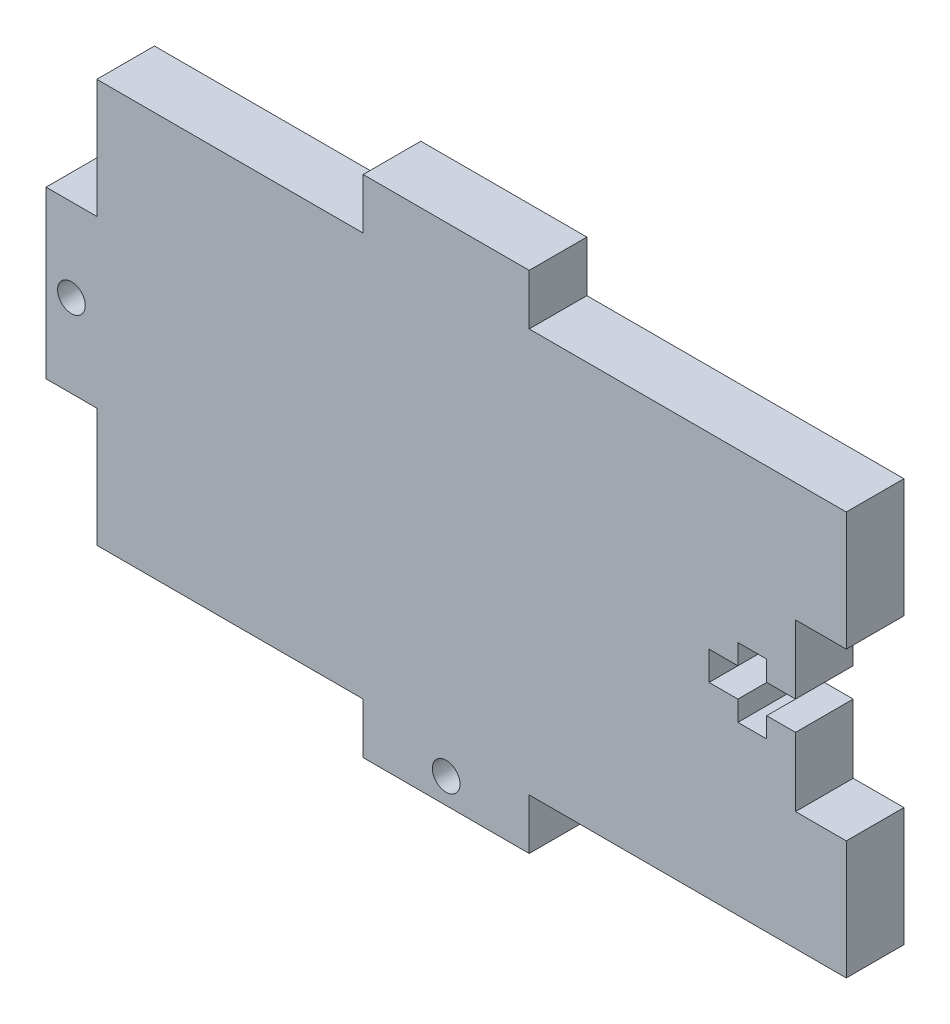
from build123d import *

# Parameters (mm, degrees)
SKETCH1_W           = 82.55
SKETCH1_H           = 44.45
BOSS_EXTRUDE1_DEPTH = 6.35
SKETCH2_W           = 5.588
SKETCH2_H           = 18.288
BOSS_EXTRUDE2_DEPTH = 6.35
SKETCH5_W           = 18.288
SKETCH5_H           = 5.588
BOSS_EXTRUDE3_DEPTH = 6.35
SKETCH3_W           = 5.588
SKETCH3_H           = 18.288
CUT_EXTRUDE1_DEPTH  = 97.739994025
SKETCH6_R           = 1.524
CUT_EXTRUDE2_DEPTH  = 97.739994025


with BuildPart() as part:
    # Sketch1 → Boss-Extrude1 (new body)
    with BuildSketch(Plane.XY):
        with Locations((41.275, 22.225)):
            Rectangle(SKETCH1_W, SKETCH1_H)
    extrude(amount=BOSS_EXTRUDE1_DEPTH)

    # Sketch2 → Boss-Extrude2 (add)
    with BuildSketch(Plane.XY.offset(6.35)):
        with Locations((-2.794, 22.225)):
            Rectangle(SKETCH2_W, SKETCH2_H)
    extrude(amount=-BOSS_EXTRUDE2_DEPTH)

    # Sketch5 → Boss-Extrude3 (add)
    with BuildSketch(Plane.XY.offset(6.35)):
        with Locations((38.481, 47.244)):
            Rectangle(SKETCH5_W, SKETCH5_H)
        with Locations((38.481, -2.794)):
            Rectangle(SKETCH5_W, SKETCH5_H)
    extrude(amount=-BOSS_EXTRUDE3_DEPTH)

    # Sketch3 → Cut-Extrude1 (cut, through all)
    with BuildSketch(Plane.XY.offset(6.35)):
        with Locations((79.756, 22.225)):
            Rectangle(SKETCH3_W, SKETCH3_H)
    extrude(amount=-CUT_EXTRUDE1_DEPTH, mode=Mode.SUBTRACT)

    # Sketch6 → Cut-Extrude2 (cut, through all)
    with BuildSketch(Plane.XY.offset(6.35)):
        with Locations((-2.794, 22.225)):
            Circle(SKETCH6_R)
        with Locations((38.481, -2.794)):
            Circle(SKETCH6_R)
        Polygon((67.437, 23.8125), (70.612, 23.8125), (70.612, 26.035), (73.787, 26.035), (73.787, 23.8125), (76.962, 23.8125), (76.962, 20.6375), (73.787, 20.6375), (73.787, 18.415), (70.612, 18.415), (70.612, 20.6375), (67.437, 20.6375), align=None)
    extrude(amount=-CUT_EXTRUDE2_DEPTH, mode=Mode.SUBTRACT)


solid = part.part
